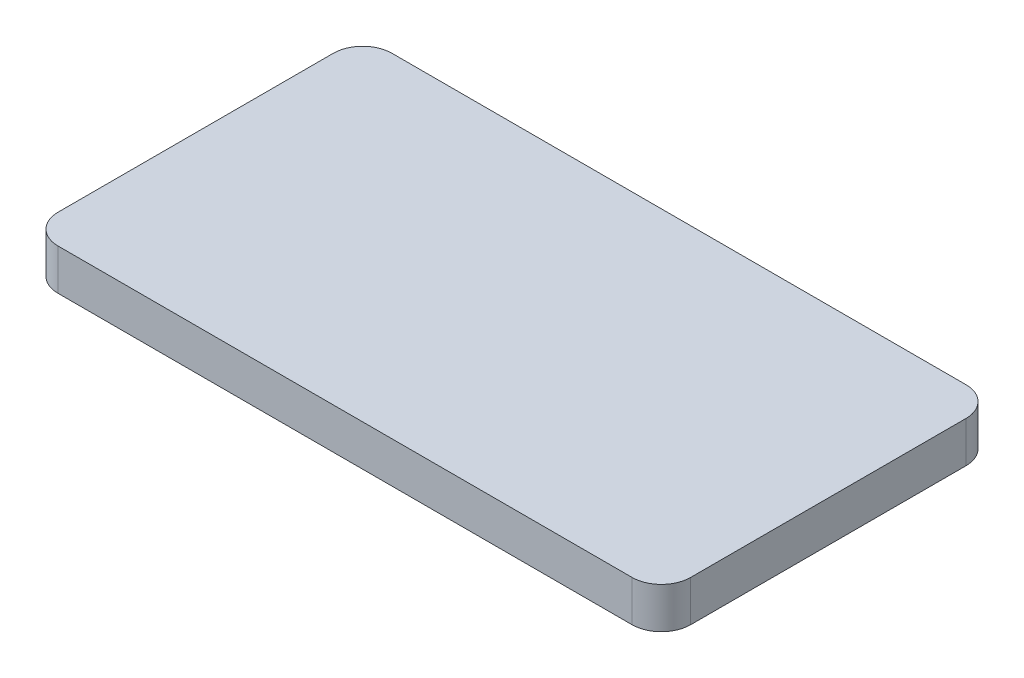
from build123d import *

# Parameters (mm, degrees)
BOSS_EXTRUDE1_DEPTH = 7


with BuildPart() as part:
    # Sketch1 → Boss-Extrude1 (new body)
    with BuildSketch(Plane(origin=(0, 0, 0), x_dir=(1, 0, 0), z_dir=(0, 1, 0))):
        with BuildLine():
            Line((-49, 28.5), (49, 28.5))
            ThreePointArc((49, 28.5), (52.535533906, 27.035533906), (54, 23.5))
            Line((54, 23.5), (54, -23.5))
            ThreePointArc((54, -23.5), (52.535533906, -27.035533906), (49, -28.5))
            Line((49, -28.5), (-49, -28.5))
            ThreePointArc((-49, -28.5), (-52.535533906, -27.035533906), (-54, -23.5))
            Line((-54, -23.5), (-54, 23.5))
            ThreePointArc((-54, 23.5), (-52.535533906, 27.035533906), (-49, 28.5))
        make_face()
    extrude(amount=BOSS_EXTRUDE1_DEPTH)


solid = part.part
